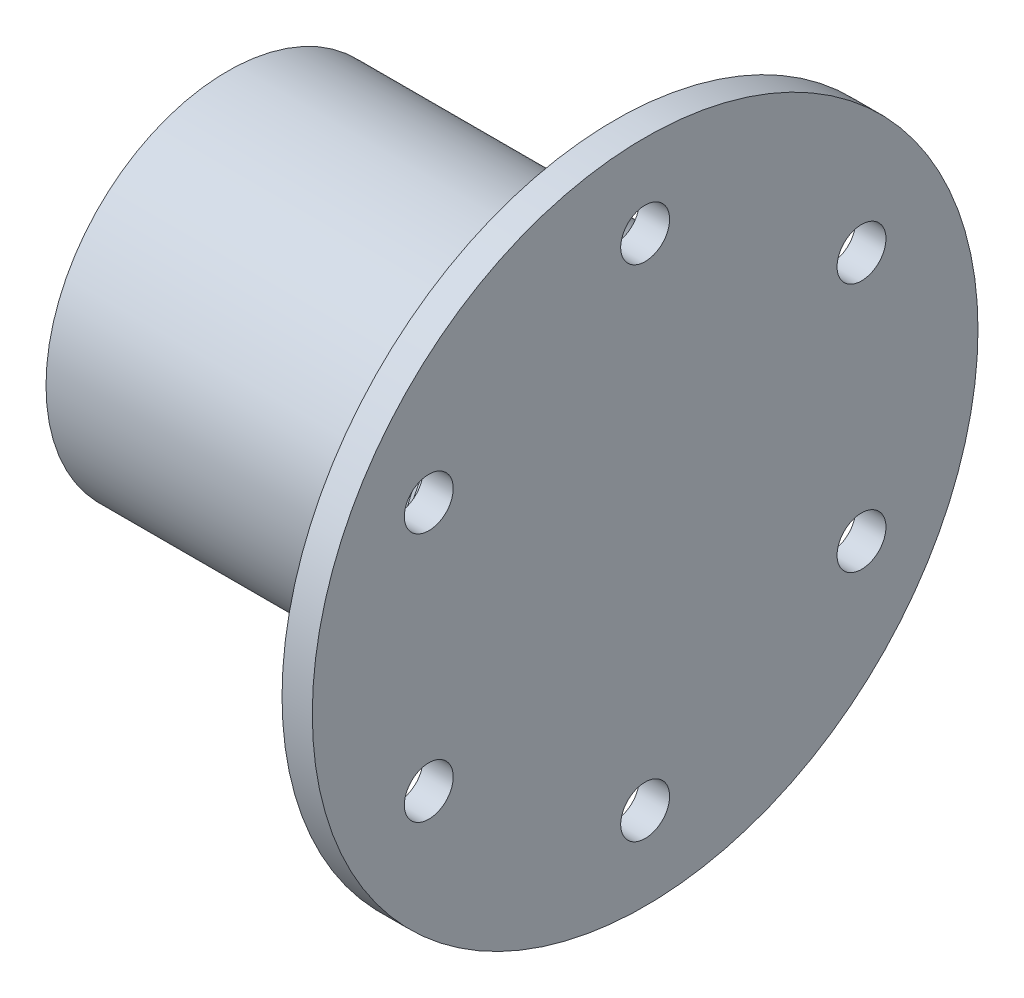
from build123d import *

# Parameters (mm, degrees)
SKETCH1_R           = 27.5
SKETCH1_R_2         = 2.0193
BOSS_EXTRUDE1_DEPTH = 2.5
SKETCH2_R           = 17.46
BOSS_EXTRUDE2_DEPTH = 2
CHAMFER5_SIZE       = 1
SKETCH6_R           = 15
BOSS_EXTRUDE3_DEPTH = 30


with BuildPart() as part:
    # Sketch1 → Boss-Extrude1 (new body)
    with BuildSketch(Plane(origin=(0, 0, 0), x_dir=(0, 0, -1), z_dir=(1, 0, 0))):
        Circle(SKETCH1_R)
        with Locations((0, 20.64)):
            Circle(SKETCH1_R_2, mode=Mode.SUBTRACT)
        with Locations((17.874764334, 10.32)):
            Circle(SKETCH1_R_2, mode=Mode.SUBTRACT)
        with Locations((17.874764334, -10.32)):
            Circle(SKETCH1_R_2, mode=Mode.SUBTRACT)
        with Locations((0, -20.64)):
            Circle(SKETCH1_R_2, mode=Mode.SUBTRACT)
        with Locations((-17.874764334, -10.32)):
            Circle(SKETCH1_R_2, mode=Mode.SUBTRACT)
        with Locations((-17.874764334, 10.32)):
            Circle(SKETCH1_R_2, mode=Mode.SUBTRACT)
    extrude(amount=BOSS_EXTRUDE1_DEPTH)

    # Sketch2 → Boss-Extrude2 (add)
    with BuildSketch(Plane.ZY):
        with Locations(Location((0, 0, 0), (0, 0, 180))):
            Circle(SKETCH2_R)
    extrude(amount=BOSS_EXTRUDE2_DEPTH)

    # Chamfer5
    chamfer5_edges = [part.edges().sort_by_distance(p)[0] for p in [
        (-2, 0, 17.46),
    ]]
    chamfer(chamfer5_edges, length=CHAMFER5_SIZE)

    # Sketch6 → Boss-Extrude3 (add)
    with BuildSketch(Plane(origin=(-2, 0, 0), x_dir=(0, 0, -1), z_dir=(1, 0, 0))):
        Circle(SKETCH6_R)
    extrude(amount=-BOSS_EXTRUDE3_DEPTH)


solid = part.part
